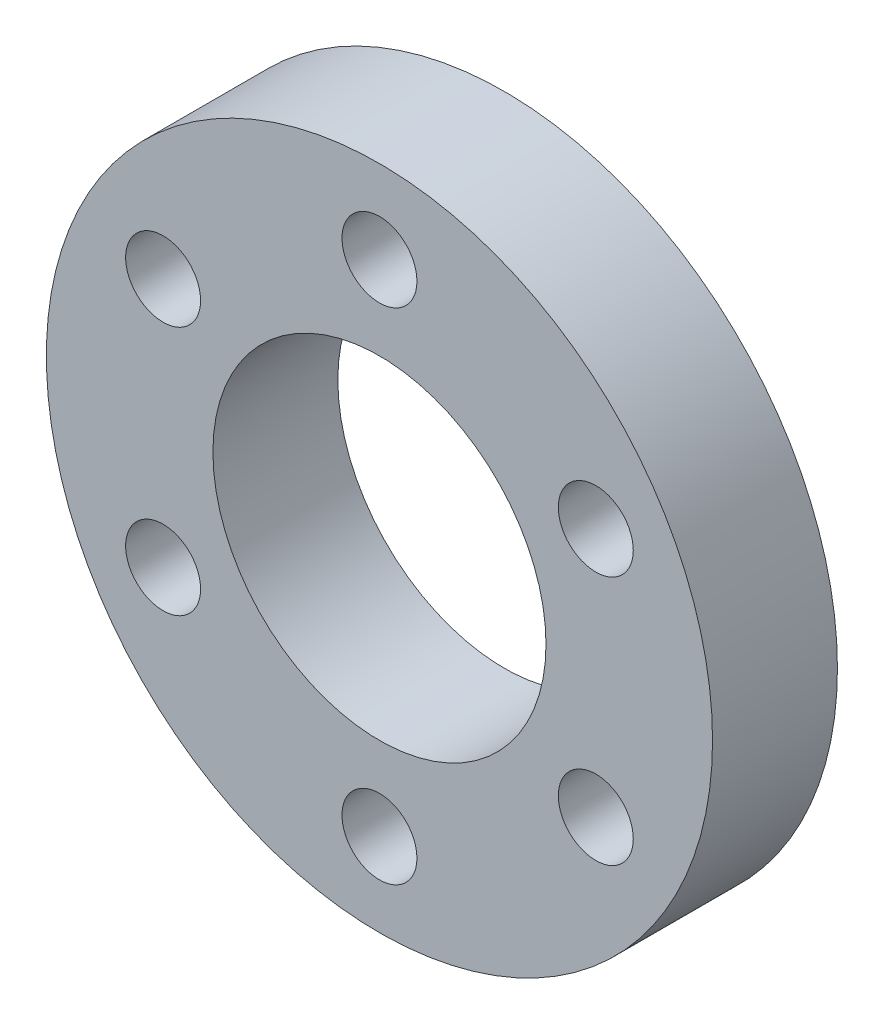
from build123d import *

# Parameters (mm, degrees)
ESBO_O1_R                 = 8
ESBO_O1_R_2               = 4
RESSALTO_EXTRUS_O1_DEPTH  = 3
FURO_COM_FOLGA_DE_M1_61_D = 1.8
PADR_OCIRCULAR1_COUNT     = 6


with BuildPart() as part:
    # Esboço1 → Ressalto-extrusão1 (new body)
    with BuildSketch(Plane.XY):
        Circle(ESBO_O1_R)
        Circle(ESBO_O1_R_2, mode=Mode.SUBTRACT)
    extrude(amount=RESSALTO_EXTRUS_O1_DEPTH)

    # Furo com folga de M1.61 (through all)
    with Locations(Plane(origin=(0, 6, 3), x_dir=(1, 0, 0), z_dir=(0, 0, 1))):
        with Locations((0, 0)):
            furo_com_folga_de_m1_61 = Hole(FURO_COM_FOLGA_DE_M1_61_D / 2)

    # PadrãoCircular1: Furo com folga de M1.61 ×6 about axis
    padr_ocircular1_axis = Axis((0, 0, 0), (0, 0, 1))
    for i in range(1, PADR_OCIRCULAR1_COUNT):
        add(furo_com_folga_de_m1_61.rotate(padr_ocircular1_axis, i * 360 / PADR_OCIRCULAR1_COUNT), mode=Mode.SUBTRACT)


solid = part.part
